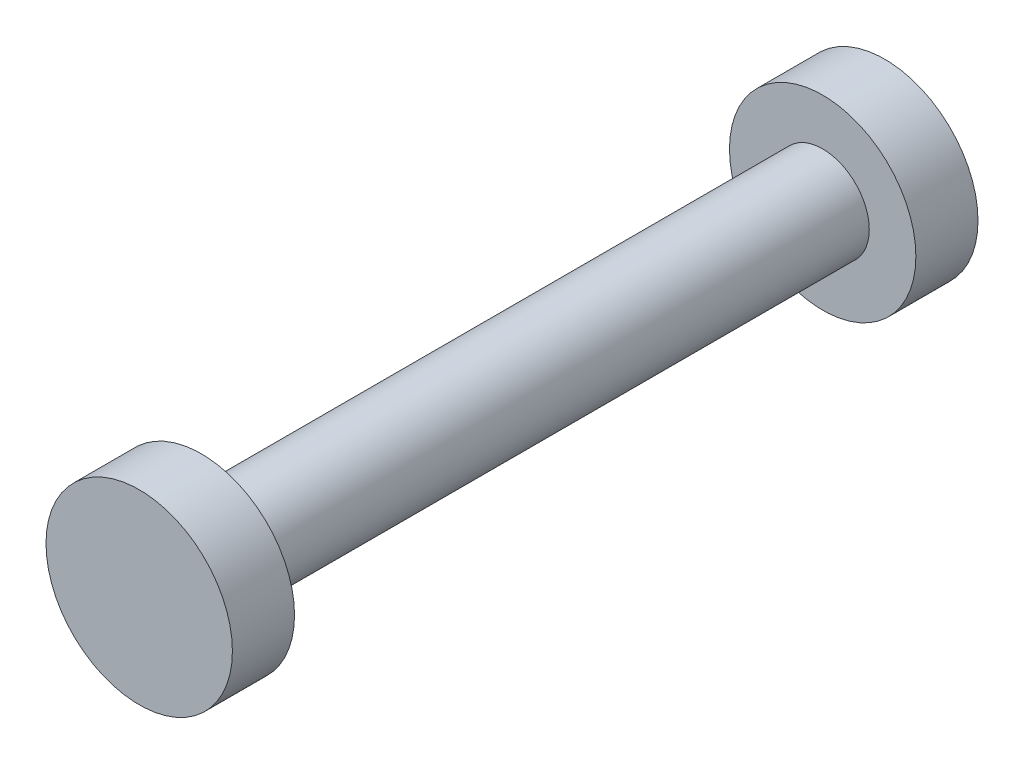
from build123d import *

# Parameters (mm, degrees)
SKETCH1_R           = 0.75
BOSS_EXTRUDE1_DEPTH = 5
SKETCH2_R           = 1.5
BOSS_EXTRUDE2_DEPTH = 1
BOSS_EXTRUDE3_START = 1
SKETCH3_R           = 1.5
BOSS_EXTRUDE3_DEPTH = 1


with BuildPart() as part:
    # Sketch1 → Boss-Extrude1 (new, symmetric)
    with BuildSketch(Plane.XY):
        Circle(SKETCH1_R)
    extrude(amount=BOSS_EXTRUDE1_DEPTH, both=True)

    # Sketch2 → Boss-Extrude2 (add)
    with BuildSketch(Plane.XY.offset(5)):
        Circle(SKETCH2_R)
    extrude(amount=BOSS_EXTRUDE2_DEPTH)

    # Sketch3 → Boss-Extrude3 (add)
    with BuildSketch(Plane(origin=(0, 0, -5), x_dir=(-1, 0, 0), z_dir=(0, 0, -1)).offset(BOSS_EXTRUDE3_START)):
        with Locations(Location((0, 0, 0), (0, 0, 180))):
            Circle(SKETCH3_R)
    extrude(amount=-BOSS_EXTRUDE3_DEPTH)


solid = part.part
